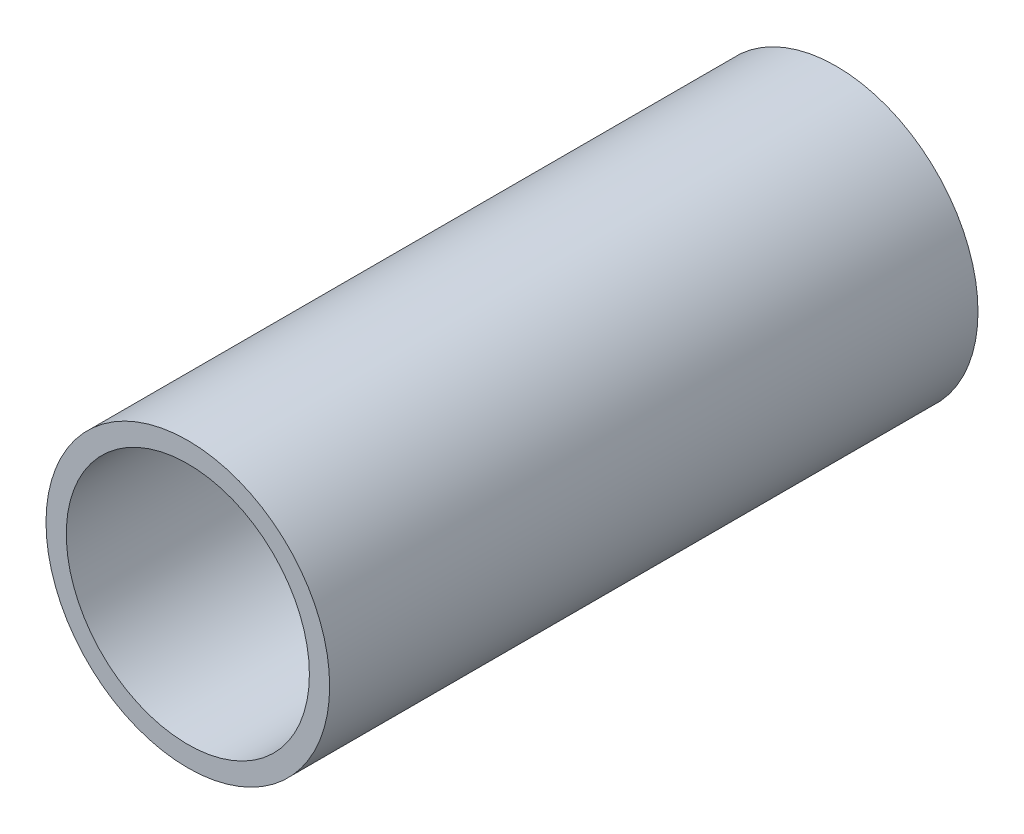
from build123d import *

# Parameters (mm, degrees)
SKETCH1_R           = 44.45
SKETCH1_R_2         = 38.1
BOSS_EXTRUDE1_DEPTH = 101.6
SKETCH1_3_R         = 38.1
SKETCH1_3_R_2       = 12.7
BOSS_EXTRUDE2_DEPTH = 25.4


with BuildPart() as part:
    # Sketch1 → Boss-Extrude1 (new, symmetric)
    with BuildSketch(Plane.XY):
        Circle(SKETCH1_R)
        Circle(SKETCH1_R_2, mode=Mode.SUBTRACT)
    extrude(amount=BOSS_EXTRUDE1_DEPTH, both=True)

    # Sketch1<3> → Boss-Extrude2 (add, symmetric)
    with BuildSketch(Plane.XY):
        Circle(SKETCH1_3_R)
        Circle(SKETCH1_3_R_2, mode=Mode.SUBTRACT)
    extrude(amount=BOSS_EXTRUDE2_DEPTH, both=True)


solid = part.part
